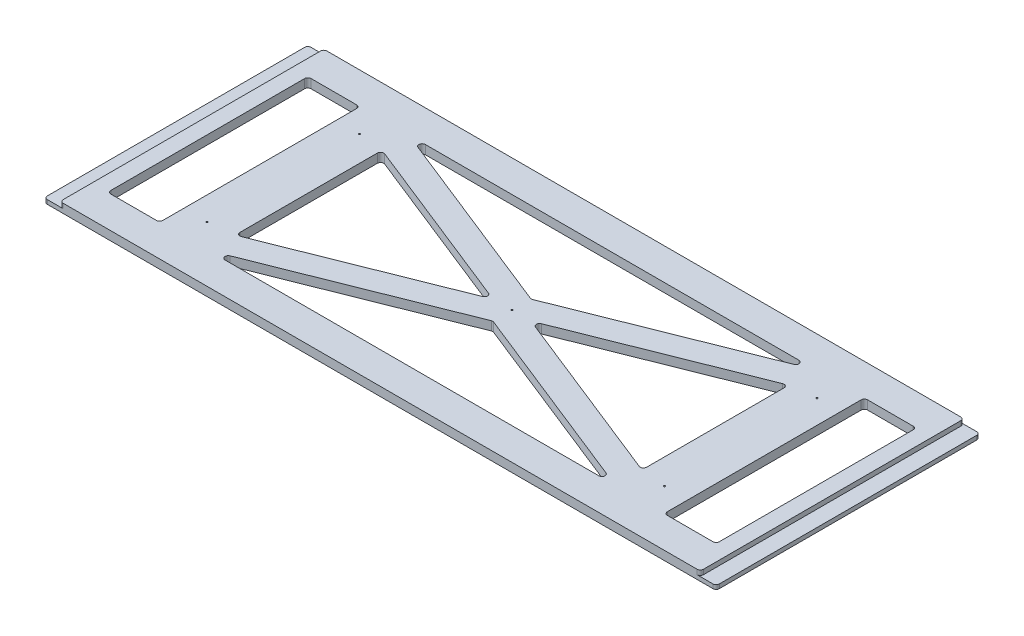
from build123d import *

# Parameters (mm, degrees)
SKETCH1_W                    = 1343.025
SKETCH1_H                    = 527.05
BOSS_EXTRUDE1_DEPTH          = 17.78
FILLET1_R                    = 6.35
F_1_8_0_125_DIAMETER_HOLE1_D = 3.175
SKETCH5_W                    = 103.867264199
SKETCH5_H                    = 400.05
CUT_EXTRUDE1_DEPTH           = 722.588935393
CUT_EXTRUDE2_DEPTH           = 9.525
FILLET2_R                    = 6.35


with BuildPart() as part:
    # Sketch1 → Boss-Extrude1 (new body)
    with BuildSketch(Plane(origin=(0, 0, 0), x_dir=(1, 0, 0), z_dir=(0, 1, 0))):
        Rectangle(SKETCH1_W, SKETCH1_H)
    extrude(amount=BOSS_EXTRUDE1_DEPTH)

    # Fillet1
    fillet1_edges = [part.edges().sort_by_distance(p)[0] for p in [
        (671.5125, 8.89, 263.525),
        (-671.5125, 8.89, 263.525),
        (-671.5125, 8.89, -263.525),
        (671.5125, 8.89, -263.525),
    ]]
    fillet(fillet1_edges, radius=FILLET1_R)

    # 1/8 (0.125) Diameter Hole1 (through all)
    with Locations(Plane(origin=(0, 17.78, 0), x_dir=(1, 0, 0), z_dir=(0, 1, 0))):
        with Locations((0, 0), (457.2, 152.4), (-457.2, -152.4), (-457.2, 152.4), (457.2, -152.4)):
            Hole(F_1_8_0_125_DIAMETER_HOLE1_D / 2)

    # Sketch5 → Cut-Extrude1 (cut, through all)
    with BuildSketch(Plane(origin=(0, 17.78, 0), x_dir=(1, 0, 0), z_dir=(0, 1, 0))):
        Polygon((-406.4, 200.025), (406.4, 200.025), (0, 38.1), align=None)
        Polygon((0, -38.1), (-406.4, -200.025), (406.4, -200.025), align=None)
        Polygon((406.4, 146.74453125), (406.4, -146.74453125), (38.1, 0), align=None)
        Polygon((-406.4, 146.74453125), (-38.1, 0), (-406.4, -146.74453125), align=None)
        with Locations((556.0788679, 0)):
            Rectangle(SKETCH5_W, SKETCH5_H)
        with Locations((-556.0788679, 0)):
            Rectangle(SKETCH5_W, SKETCH5_H)
    extrude(amount=-CUT_EXTRUDE1_DEPTH, mode=Mode.SUBTRACT)

    # Sketch6 → Cut-Extrude2 (cut)
    with BuildSketch(Plane(origin=(0, 17.78, 0), x_dir=(1, 0, 0), z_dir=(0, 1, 0))):
        with BuildLine():
            Line((639.7625, -263.525), (665.1625, -263.525))
            ThreePointArc((665.1625, -263.525), (669.652628061, -261.665128061), (671.5125, -257.175))
            Line((671.5125, -257.175), (671.5125, 257.175))
            ThreePointArc((671.5125, 257.175), (669.652628061, 261.665128061), (665.1625, 263.525))
            Line((665.1625, 263.525), (639.7625, 263.525))
            Line((639.7625, 263.525), (639.7625, -263.525))
        make_face()
        with BuildLine():
            Line((-639.7625, -263.525), (-665.1625, -263.525))
            ThreePointArc((-665.1625, -263.525), (-669.652628061, -261.665128061), (-671.5125, -257.175))
            Line((-671.5125, -257.175), (-671.5125, 257.175))
            ThreePointArc((-671.5125, 257.175), (-669.652628061, 261.665128061), (-665.1625, 263.525))
            Line((-665.1625, 263.525), (-639.7625, 263.525))
            Line((-639.7625, 263.525), (-639.7625, -263.525))
        make_face()
    extrude(amount=-CUT_EXTRUDE2_DEPTH, mode=Mode.SUBTRACT)

    # Fillet2
    fillet2_edges = [part.edges().sort_by_distance(p)[0] for p in [
        (-504.145235801, 8.89, -200.025),
        (-504.145235801, 8.89, 200.025),
        (-608.0125, 8.89, 200.025),
        (-608.0125, 8.89, -200.025),
        (-406.4, 8.89, 146.74453125),
        (-406.4, 8.89, -146.74453125),
        (-38.1, 8.89, 0),
        (608.0125, 8.89, -200.025),
        (608.0125, 8.89, 200.025),
        (504.145235801, 8.89, 200.025),
        (504.145235801, 8.89, -200.025),
        (0, 8.89, 38.1),
        (406.4, 8.89, 200.025),
        (-406.4, 8.89, 200.025),
        (38.1, 8.89, 0),
        (406.4, 8.89, -146.74453125),
        (406.4, 8.89, 146.74453125),
        (639.7625, 13.0175, 263.525),
        (639.7625, 13.0175, -263.525),
        (-639.7625, 13.0175, -263.525),
        (-639.7625, 13.0175, 263.525),
        (406.4, 8.89, -200.025),
        (0, 8.89, -38.1),
        (-406.4, 8.89, -200.025),
    ]]
    fillet(fillet2_edges, radius=FILLET2_R)


solid = part.part
